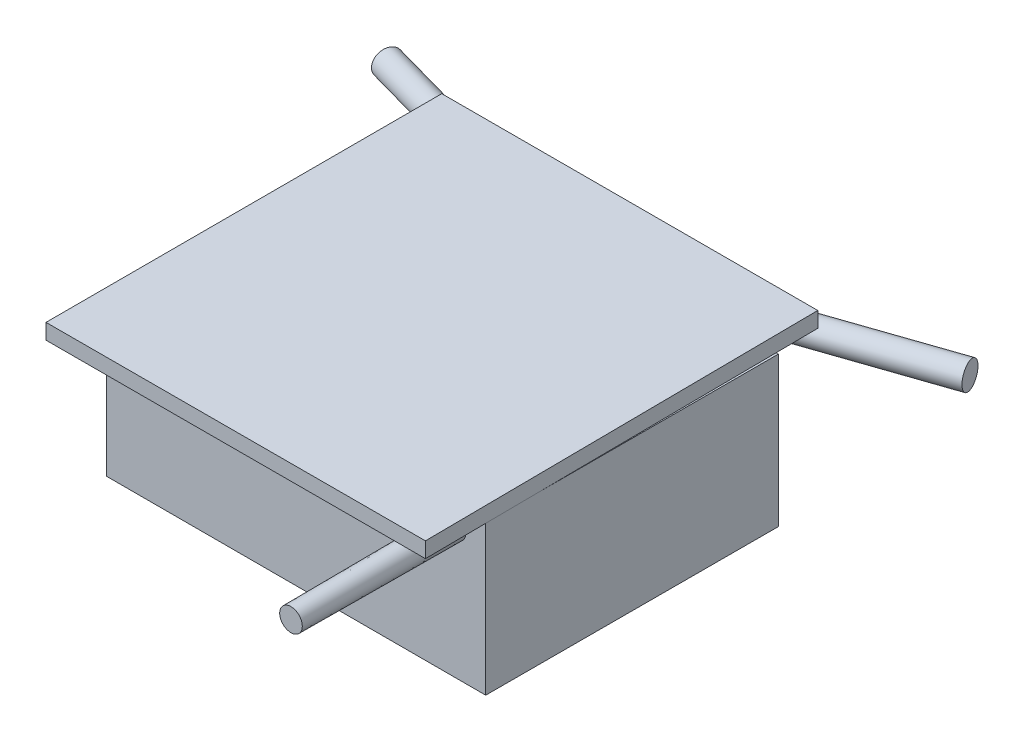
from build123d import *

# Parameters (mm, degrees)
EXTRUDE_1_DEPTH     = 320
EXTRUDE_2_DEPTH     = 30
CUT_EXTRUDE_1_DEPTH = 30
SKETCH_4_R          = 25
EXTRUDE_3_DEPTH     = 580
EXTRUDE_3_TAPER     = 0.3
SKETCH_8_R          = 25
EXTRUDE_4_DEPTH     = 557.556275
SKETCH_9_R          = 25
EXTRUDE_5_DEPTH     = 585.675678


with BuildPart() as part:
    # 草图1 → 凸台-拉伸1 (new body)
    with BuildSketch(Plane(origin=(0, 0, 0), x_dir=(1, 0, 0), z_dir=(0, 1, 0))):
        Polygon((368, -264), (-368, -264), (-367, 301), (368.6, 303.3), align=None)
    extrude(amount=EXTRUDE_1_DEPTH)

    # 草图2 → 凸台-拉伸2 (add)
    with BuildSketch(Plane(origin=(0, 320, 0), x_dir=(1, 0, 0), z_dir=(0, 1, 0))):
        Polygon((363.5, 385), (370, -383), (-365.5, -384), (-365.8, 384.5), align=None)
    extrude(amount=-EXTRUDE_2_DEPTH)

    # 草图3 → 切除-拉伸1 (cut)
    with BuildSketch(Plane(origin=(0, 320, 0), x_dir=(1, 0, 0), z_dir=(0, 1, 0))):
        Polygon((364.191588014, 303.286216221), (368.110287471, -159.723196528), (368.6, 303.3), align=None)
        Polygon((-365.767405538, 301.003853952), (-365.546844502, -264), (-368, -264), (-367, 301), align=None)
    extrude(amount=-CUT_EXTRUDE_1_DEPTH, mode=Mode.SUBTRACT)

    # 草图4 → 凸台-拉伸3 (add)
    with BuildSketch(Plane.XY):
        with Locations((306, 254)):
            Circle(SKETCH_4_R)
    extrude(amount=EXTRUDE_3_DEPTH, taper=EXTRUDE_3_TAPER)

    # 草图8 → 凸台-拉伸4 (add)
    with BuildSketch(Plane(origin=(0, 254, -300), x_dir=(0.26903113941240836, 0, -0.9631314790964218), z_dir=(0.9631314790964218, 0, 0.26903113941240836))):
        Circle(SKETCH_8_R)
    extrude(amount=-EXTRUDE_4_DEPTH)

    # 草图9 → 凸台-拉伸5 (add)
    with BuildSketch(Plane(origin=(0, 254, -300), x_dir=(0.3244116275984733, 0, 0.9459160088923908), z_dir=(-0.9459160088923909, 0, 0.3244116275984733))):
        Circle(SKETCH_9_R)
    extrude(amount=-EXTRUDE_5_DEPTH)


solid = part.part
